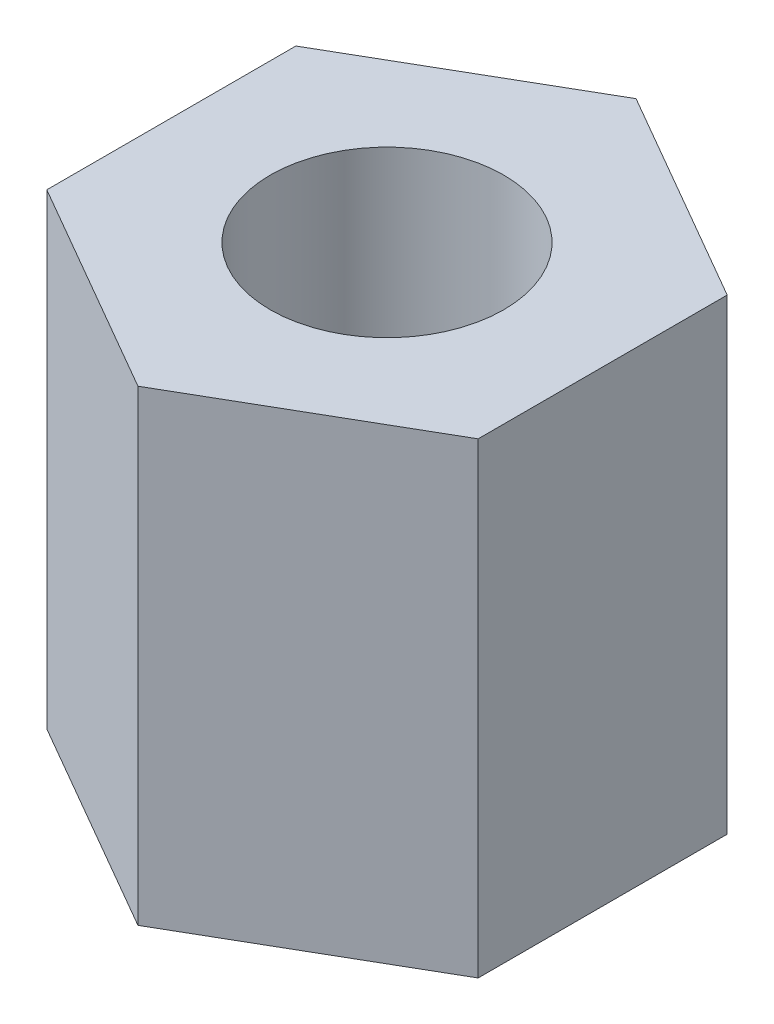
from build123d import *

# Parameters (mm, degrees)
SKETCH1_R           = 3.75
BOSS_EXTRUDE1_DEPTH = 15


with BuildPart() as part:
    # Sketch1 → Boss-Extrude1 (new body)
    with BuildSketch(Plane(origin=(0, 0, 0), x_dir=(1, 0, 0), z_dir=(0, 1, 0))):
        Polygon((0, 8), (-6.92820323, 4), (-6.92820323, -4), (0, -8), (6.92820323, -4), (6.92820323, 4), align=None)
        with Locations(Location((0, 0, 0), (0, 0, 270))):
            Circle(SKETCH1_R, mode=Mode.SUBTRACT)
    extrude(amount=BOSS_EXTRUDE1_DEPTH)


solid = part.part
